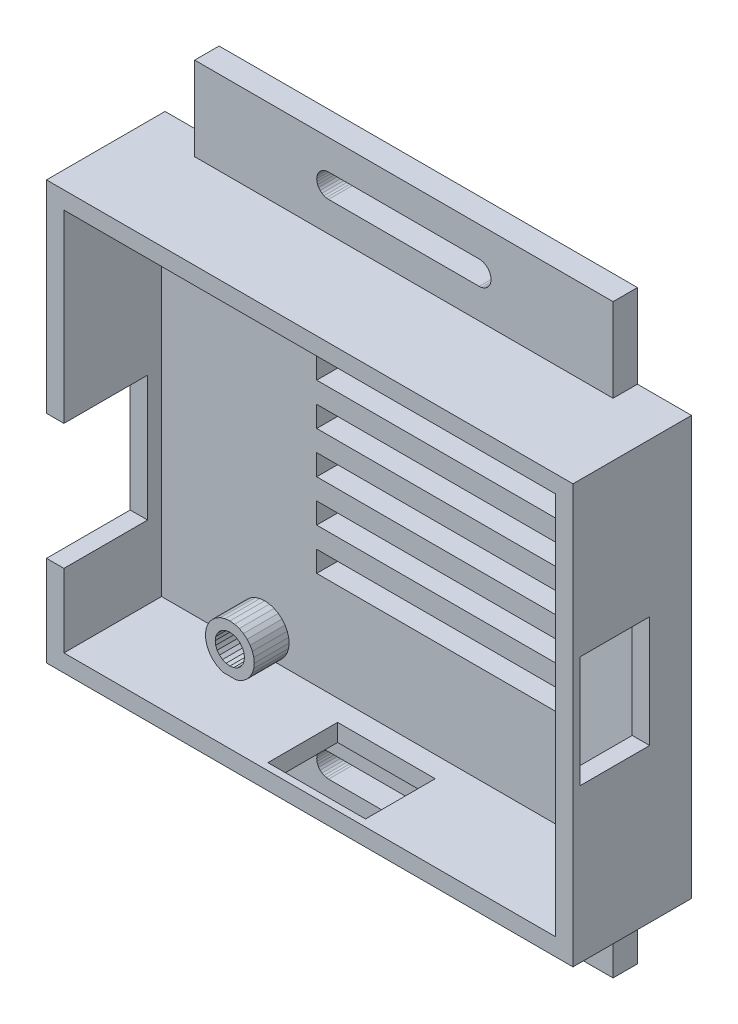
from build123d import *

# Parameters (mm, degrees)
SKETCH1_W           = 75.499996542
SKETCH1_H           = 59.999998658
BOSS_EXTRUDE1_DEPTH = 17.000000924
SKETCH2_W           = 70.500001312
SKETCH2_H           = 54.999999702
CUT_EXTRUDE1_DEPTH  = 14.000000898
CUT_EXTRUDE2_REACH  = 85.002
SKETCH3_W           = 12.000001036
SKETCH3_H           = 18.000000971
SKETCH4_W           = 59.999998658
SKETCH4_H           = 3.500000108
BOSS_EXTRUDE2_DEPTH = 12.000000104
CUT_EXTRUDE3_DEPTH  = 59.063003229
SKETCH6_W           = 59.999998658
SKETCH6_H           = 3.500000108
BOSS_EXTRUDE3_DEPTH = 12.000000104
CUT_EXTRUDE4_DEPTH  = 59.063003229
SKETCH8_W           = 36.000000313
SKETCH8_H           = 3.000000491
CUT_EXTRUDE5_DEPTH  = 59.181288634
SKETCH9_W           = 36.000000313
SKETCH9_H           = 3.000000026
CUT_EXTRUDE6_DEPTH  = 59.181288634
SKETCH10_W          = 36.000000313
SKETCH10_H          = 3.000000492
CUT_EXTRUDE7_DEPTH  = 59.181288634
SKETCH11_W          = 36.000000313
SKETCH11_H          = 3.000000026
CUT_EXTRUDE8_DEPTH  = 59.181288634
SKETCH12_W          = 36.000000313
SKETCH12_H          = 3.000000492
CUT_EXTRUDE9_DEPTH  = 59.181288634
SKETCH13_W          = 36.000000313
SKETCH13_H          = 3.000000026
CUT_EXTRUDE10_DEPTH = 59.181288634
SKETCH14_W          = 10.000000708
SKETCH14_H          = 16.00000076
CUT_EXTRUDE11_DEPTH = 86.91856509
CUT_EXTRUDE12_REACH = 85.055
SKETCH15_W          = 14.000000432
SKETCH15_H          = 10.000000708
BOSS_EXTRUDE4_DEPTH = 5.000000354
CUT_EXTRUDE13_DEPTH = 5.500000436
BOSS_EXTRUDE5_DEPTH = 5.000000354
CUT_EXTRUDE14_DEPTH = 5.500000436
BOSS_EXTRUDE6_DEPTH = 5.000000354
CUT_EXTRUDE15_DEPTH = 5.500000436
BOSS_EXTRUDE7_DEPTH = 5.000000354
CUT_EXTRUDE16_DEPTH = 5.500000436


with BuildPart() as part:
    # Sketch1 → Boss-Extrude1 (new body)
    with BuildSketch(Plane(origin=(0, 0, 0), x_dir=(-1, 0, 0), z_dir=(0, 0, -1))):
        Rectangle(SKETCH1_W, SKETCH1_H)
    extrude(amount=-BOSS_EXTRUDE1_DEPTH)

    # Sketch2 → Cut-Extrude1 (cut)
    with BuildSketch(Plane.XY.offset(17.000000924)):
        Rectangle(SKETCH2_W, SKETCH2_H)
    extrude(amount=-CUT_EXTRUDE1_DEPTH, mode=Mode.SUBTRACT)

    # Sketch3 → Cut-Extrude2 (cut, up to next)
    with BuildSketch(Plane.ZY.offset(37.749998271), mode=Mode.PRIVATE) as cut_extrude2_sk1:
        with Locations((11.000000406, -8.000000439)):
            Rectangle(SKETCH3_W, SKETCH3_H)
    cut_extrude2_tool1 = extrude(cut_extrude2_sk1.sketch, amount=-CUT_EXTRUDE2_REACH, mode=Mode.PRIVATE) & part.part
    add(cut_extrude2_tool1.solids().sort_by_distance((-37.749998, -8, 11))[0], mode=Mode.SUBTRACT)

    # Sketch4 → Boss-Extrude2 (add)
    with BuildSketch(Plane(origin=(0, 29.999999329, 0), x_dir=(-1, 0, 0), z_dir=(0, 1, 0))):
        with Locations((0, 1.750000054)):
            Rectangle(SKETCH4_W, SKETCH4_H)
    extrude(amount=BOSS_EXTRUDE2_DEPTH)

    # Sketch5 → Cut-Extrude3 (cut, through all)
    with BuildSketch(Plane.XY.offset(3.500000108)):
        Polygon((12.370594777, 36.650560796), (12.213498354, 36.9444713), (12.00208161, 37.202078849), (11.744469404, 37.413496524), (11.450561695, 37.570595741), (11.131653562, 37.66733408), (10.80000028, 37.70000115), (-10.80000028, 37.70000115), (-11.131653562, 37.66733408), (-11.450561695, 37.570595741), (-11.744469404, 37.413496524), (-12.00208161, 37.202078849), (-12.213498354, 36.9444713), (-12.370594777, 36.650560796), (-12.467334978, 36.331653595), (-12.500000186, 35.99999845), (-12.467334978, 35.668347031), (-12.370594777, 35.349436104), (-12.213498354, 35.055529326), (-12.00208161, 34.797921777), (-11.744469404, 34.586500376), (-11.450561695, 34.429404885), (-11.131653562, 34.332662821), (-10.80000028, 34.299999475), (10.80000028, 34.299999475), (11.131653562, 34.332662821), (11.450561695, 34.429404885), (11.744469404, 34.586500376), (12.00208161, 34.797921777), (12.213498354, 35.055529326), (12.370594777, 35.349436104), (12.467334978, 35.668347031), (12.500000186, 35.99999845), (12.467334978, 36.331653595), align=None)
    extrude(amount=-CUT_EXTRUDE3_DEPTH, mode=Mode.SUBTRACT)

    # Sketch6 → Boss-Extrude3 (add)
    with BuildSketch(Plane.XZ.offset(29.999999329)):
        with Locations((0, 1.750000054)):
            Rectangle(SKETCH6_W, SKETCH6_H)
    extrude(amount=BOSS_EXTRUDE3_DEPTH)

    # Sketch7 → Cut-Extrude4 (cut, through all)
    with BuildSketch(Plane.XY.offset(3.500000108)):
        Polygon((12.500000186, -35.99999845), (12.467334978, -35.668347031), (12.370594777, -35.349436104), (12.213498354, -35.055529326), (12.00208161, -34.797921777), (11.744469404, -34.586500376), (11.450561695, -34.429404885), (11.131653562, -34.332662821), (10.80000028, -34.299999475), (-10.80000028, -34.299999475), (-11.131653562, -34.332662821), (-11.450561695, -34.429404885), (-11.744469404, -34.586500376), (-12.00208161, -34.797921777), (-12.213498354, -35.055529326), (-12.370594777, -35.349436104), (-12.467334978, -35.668347031), (-12.500000186, -35.99999845), (-12.467334978, -36.331653595), (-12.370594777, -36.650560796), (-12.213498354, -36.9444713), (-12.00208161, -37.202078849), (-11.744469404, -37.413496524), (-11.450561695, -37.570595741), (-11.131653562, -37.66733408), (-10.80000028, -37.70000115), (10.80000028, -37.70000115), (11.131653562, -37.66733408), (11.450561695, -37.570595741), (11.744469404, -37.413496524), (12.00208161, -37.202078849), (12.213498354, -36.9444713), (12.370594777, -36.650560796), (12.467334978, -36.331653595), align=None)
    extrude(amount=-CUT_EXTRUDE4_DEPTH, mode=Mode.SUBTRACT)

    # Sketch8 → Cut-Extrude5 (cut, through all)
    with BuildSketch(Plane.XY.offset(3.000000026)):
        with Locations((4.999999888, 18.000000157)):
            Rectangle(SKETCH8_W, SKETCH8_H)
    extrude(amount=-CUT_EXTRUDE5_DEPTH, mode=Mode.SUBTRACT)

    # Sketch9 → Cut-Extrude6 (cut, through all)
    with BuildSketch(Plane.XY.offset(3.000000026)):
        with Locations((4.999999888, -5.999999819)):
            Rectangle(SKETCH9_W, SKETCH9_H)
    extrude(amount=-CUT_EXTRUDE6_DEPTH, mode=Mode.SUBTRACT)

    # Sketch10 → Cut-Extrude7 (cut, through all)
    with BuildSketch(Plane.XY.offset(3.000000026)):
        with Locations((4.999999888, 12.000000104)):
            Rectangle(SKETCH10_W, SKETCH10_H)
    extrude(amount=-CUT_EXTRUDE7_DEPTH, mode=Mode.SUBTRACT)

    # Sketch11 → Cut-Extrude8 (cut, through all)
    with BuildSketch(Plane.XY.offset(3.000000026)):
        with Locations((4.999999888, 5.999999819)):
            Rectangle(SKETCH11_W, SKETCH11_H)
    extrude(amount=-CUT_EXTRUDE8_DEPTH, mode=Mode.SUBTRACT)

    # Sketch12 → Cut-Extrude9 (cut, through all)
    with BuildSketch(Plane.XY.offset(3.000000026)):
        with Locations((4.999999888, -12.000000104)):
            Rectangle(SKETCH12_W, SKETCH12_H)
    extrude(amount=-CUT_EXTRUDE9_DEPTH, mode=Mode.SUBTRACT)

    # Sketch13 → Cut-Extrude10 (cut, through all)
    with BuildSketch(Plane.XY.offset(3.000000026)):
        with Locations((4.999999888, 0)):
            Rectangle(SKETCH13_W, SKETCH13_H)
    extrude(amount=-CUT_EXTRUDE10_DEPTH, mode=Mode.SUBTRACT)

    # Sketch14 → Cut-Extrude11 (cut, through all)
    with BuildSketch(Plane.ZY.offset(-35.250000656)):
        with Locations((11.000000406, 0)):
            Rectangle(SKETCH14_W, SKETCH14_H)
    extrude(amount=-CUT_EXTRUDE11_DEPTH, mode=Mode.SUBTRACT)

    # Sketch15 → Cut-Extrude12 (cut, up to next)
    with BuildSketch(Plane.XZ.offset(29.999999329), mode=Mode.PRIVATE) as cut_extrude12_sk1:
        with Locations((0, 11.000000406)):
            Rectangle(SKETCH15_W, SKETCH15_H)
    cut_extrude12_tool1 = extrude(cut_extrude12_sk1.sketch, amount=-CUT_EXTRUDE12_REACH, mode=Mode.PRIVATE) & part.part
    add(cut_extrude12_tool1.solids().sort_by_distance((0, -29.999999, 11))[0], mode=Mode.SUBTRACT)

    # Sketch16 → Boss-Extrude4 (add)
    with BuildSketch(Plane.XY.offset(3.000000026)):
        Polygon((28.115000576, 8.890000172), (28.182251379, 9.572816081), (28.381422162, 10.229391977), (28.704857454, 10.834495537), (29.140127823, 11.364873499), (29.67050299, 11.800142936), (30.275607482, 12.123578228), (30.932184309, 12.32274808), (31.615000218, 12.390000746), (32.297816128, 12.32274808), (32.954391092, 12.123578228), (33.559493721, 11.800142936), (34.089874476, 11.364873499), (34.52514112, 10.834495537), (34.848578274, 10.229391977), (35.047747195, 9.572816081), (35.114999861, 8.890000172), (35.047747195, 8.207184263), (34.848578274, 7.550608367), (34.52514112, 6.945504341), (34.089874476, 6.41512638), (33.559493721, 5.979856476), (32.954391092, 5.65642165), (32.297816128, 5.457251333), (31.615000218, 5.390000064), (30.932184309, 5.457251333), (30.275607482, 5.65642165), (29.67050299, 5.979856476), (29.140127823, 6.41512638), (28.704857454, 6.945504341), (28.381422162, 7.550608367), (28.182251379, 8.207184263), align=None)
    extrude(amount=BOSS_EXTRUDE4_DEPTH)

    # Sketch17 → Cut-Extrude13 (cut)
    with BuildSketch(Plane.XY.offset(8.00000038)):
        Polygon((29.586555436, 9.433520027), (29.51500006, 8.890000172), (29.586555436, 8.346480317), (29.796347022, 7.840000093), (30.130075291, 7.40507571), (30.56500107, 7.071346976), (31.071480364, 6.86155539), (31.615000218, 6.790000014), (32.158520073, 6.86155539), (32.664999366, 7.071346976), (33.099927008, 7.40507571), (33.433653414, 7.840000093), (33.643443137, 8.346480317), (33.714998513, 8.890000172), (33.643443137, 9.433520027), (33.433653414, 9.93999932), (33.099927008, 10.374925099), (32.664999366, 10.708653368), (32.158520073, 10.918444954), (31.615000218, 10.989999399), (31.071480364, 10.918444954), (30.56500107, 10.708653368), (30.130075291, 10.374925099), (29.796347022, 9.93999932), align=None)
    extrude(amount=-CUT_EXTRUDE13_DEPTH, mode=Mode.SUBTRACT)

    # Sketch18 → Boss-Extrude5 (add)
    with BuildSketch(Plane.XY.offset(3.000000026)):
        Polygon((-20.524391904, 27.36357972), (-20.074671134, 27.499999851), (-18.295330927, 27.499999851), (-17.845608294, 27.36357972), (-17.240503803, 27.040144429), (-16.710126773, 26.60487406), (-16.274856403, 26.074495167), (-15.951421112, 25.469392538), (-15.752252191, 24.812815711), (-15.684999526, 24.129999802), (-15.752252191, 23.447183892), (-15.951421112, 22.790607065), (-16.274856403, 22.185504436), (-16.710126773, 21.655127406), (-17.240503803, 21.219857037), (-17.845608294, 20.896421745), (-18.502183259, 20.697252825), (-19.184999168, 20.629998296), (-19.86781694, 20.697252825), (-20.524391904, 20.896421745), (-21.129496396, 21.219857037), (-21.659873426, 21.655127406), (-22.095143795, 22.185504436), (-22.418579087, 22.790607065), (-22.617748007, 23.447183892), (-22.68499881, 24.129999802), (-22.617748007, 24.812815711), (-22.418579087, 25.469392538), (-22.095143795, 26.074495167), (-21.659873426, 26.60487406), (-21.129496396, 27.040144429), align=None)
    extrude(amount=BOSS_EXTRUDE5_DEPTH)

    # Sketch19 → Cut-Extrude14 (cut)
    with BuildSketch(Plane.XY.offset(8.00000038)):
        Polygon((-21.003652364, 23.080000654), (-20.669924095, 22.645074874), (-20.235000178, 22.311346605), (-19.728519022, 22.10155502), (-19.184999168, 22.030001506), (-18.641479313, 22.10155502), (-18.13500002, 22.311346605), (-17.700074241, 22.645074874), (-17.366345972, 23.080000654), (-17.156554386, 23.586479947), (-17.08499901, 24.129999802), (-17.156554386, 24.673519656), (-17.366345972, 25.180000812), (-17.700074241, 25.614922866), (-18.13500002, 25.94865486), (-18.641479313, 26.158442721), (-19.184999168, 26.229999959), (-19.728519022, 26.158442721), (-20.235000178, 25.94865486), (-20.669924095, 25.614922866), (-21.003652364, 25.180000812), (-21.21344395, 24.673519656), (-21.284999326, 24.129999802), (-21.21344395, 23.586479947), align=None)
    extrude(amount=-CUT_EXTRUDE14_DEPTH, mode=Mode.SUBTRACT)

    # Sketch20 → Boss-Extrude6 (add)
    with BuildSketch(Plane.XY.offset(3.000000026)):
        Polygon((34.089874476, -16.575125977), (34.52514112, -17.10550487), (34.848578274, -17.710607499), (35.047747195, -18.367184326), (35.114999861, -19.049998373), (35.047747195, -19.732816145), (34.848578274, -20.389392972), (34.52514112, -20.9944956), (34.089874476, -21.524874493), (33.559493721, -21.960144863), (32.954391092, -22.283578292), (32.297816128, -22.482747212), (31.615000218, -22.549999878), (30.932184309, -22.482747212), (30.275607482, -22.283578292), (29.67050299, -21.960144863), (29.140127823, -21.524874493), (28.704857454, -20.9944956), (28.381422162, -20.389392972), (28.182251379, -19.732816145), (28.115000576, -19.049998373), (28.182251379, -18.367184326), (28.381422162, -17.710607499), (28.704857454, -17.10550487), (29.140127823, -16.575125977), (29.67050299, -16.139855608), (30.275607482, -15.816422179), (30.932184309, -15.617251396), (31.615000218, -15.550000593), (32.297816128, -15.617251396), (32.954391092, -15.816422179), (33.559493721, -16.139855608), align=None)
    extrude(amount=BOSS_EXTRUDE6_DEPTH)

    # Sketch21 → Cut-Extrude15 (cut)
    with BuildSketch(Plane.XY.offset(8.00000038)):
        Polygon((31.615000218, -16.950000077), (31.071480364, -17.021555454), (30.56500107, -17.231347039), (30.130075291, -17.565075308), (29.796347022, -17.999999225), (29.586555436, -18.506478518), (29.51500006, -19.049998373), (29.586555436, -19.59352009), (29.796347022, -20.100001246), (30.130075291, -20.5349233), (30.56500107, -20.868653432), (31.071480364, -21.078443155), (31.615000218, -21.150000393), (32.158520073, -21.078443155), (32.664999366, -20.868653432), (33.099927008, -20.5349233), (33.433653414, -20.100001246), (33.643443137, -19.59352009), (33.714998513, -19.049998373), (33.643443137, -18.506478518), (33.433653414, -17.999999225), (33.099927008, -17.565075308), (32.664999366, -17.231347039), (32.158520073, -17.021555454), align=None)
    extrude(amount=-CUT_EXTRUDE15_DEPTH, mode=Mode.SUBTRACT)

    # Sketch22 → Boss-Extrude7 (add)
    with BuildSketch(Plane.XY.offset(3.000000026)):
        Polygon((-19.115608186, -27.36357972), (-19.565330818, -27.499999851), (-21.344669163, -27.499999851), (-21.794391796, -27.36357972), (-22.399496287, -27.040144429), (-22.92987518, -26.60487406), (-23.365143687, -26.074495167), (-23.688577116, -25.469392538), (-23.887747899, -24.812815711), (-23.955000564, -24.129999802), (-23.887747899, -23.447183892), (-23.688577116, -22.790607065), (-23.365143687, -22.185504436), (-22.92987518, -21.655127406), (-22.399496287, -21.219857037), (-21.794391796, -20.896421745), (-21.137814969, -20.697252825), (-20.454999059, -20.629998296), (-19.772185013, -20.697252825), (-19.115608186, -20.896421745), (-18.510503694, -21.219857037), (-17.980124801, -21.655127406), (-17.544856295, -22.185504436), (-17.221422866, -22.790607065), (-17.02225022, -23.447183892), (-16.954999417, -24.129999802), (-17.02225022, -24.812815711), (-17.221422866, -25.469392538), (-17.544856295, -26.074495167), (-17.980124801, -26.60487406), (-18.510503694, -27.040144429), align=None)
    extrude(amount=BOSS_EXTRUDE7_DEPTH)

    # Sketch23 → Cut-Extrude16 (cut)
    with BuildSketch(Plane.XY.offset(8.00000038)):
        Polygon((-22.483443841, -23.586479947), (-22.55500108, -24.129999802), (-22.483443841, -24.673519656), (-22.273652256, -25.180000812), (-21.939923987, -25.614922866), (-21.50500007, -25.94865486), (-20.998520777, -26.158442721), (-20.454999059, -26.229999959), (-19.911479205, -26.158442721), (-19.404999912, -25.94865486), (-18.970075995, -25.614922866), (-18.636347726, -25.180000812), (-18.42655614, -24.673519656), (-18.354998901, -24.129999802), (-18.42655614, -23.586479947), (-18.636347726, -23.080000654), (-18.970075995, -22.645074874), (-19.404999912, -22.311346605), (-19.911479205, -22.10155502), (-20.454999059, -22.030001506), (-20.998520777, -22.10155502), (-21.50500007, -22.311346605), (-21.939923987, -22.645074874), (-22.273652256, -23.080000654), align=None)
    extrude(amount=-CUT_EXTRUDE16_DEPTH, mode=Mode.SUBTRACT)


solid = part.part
